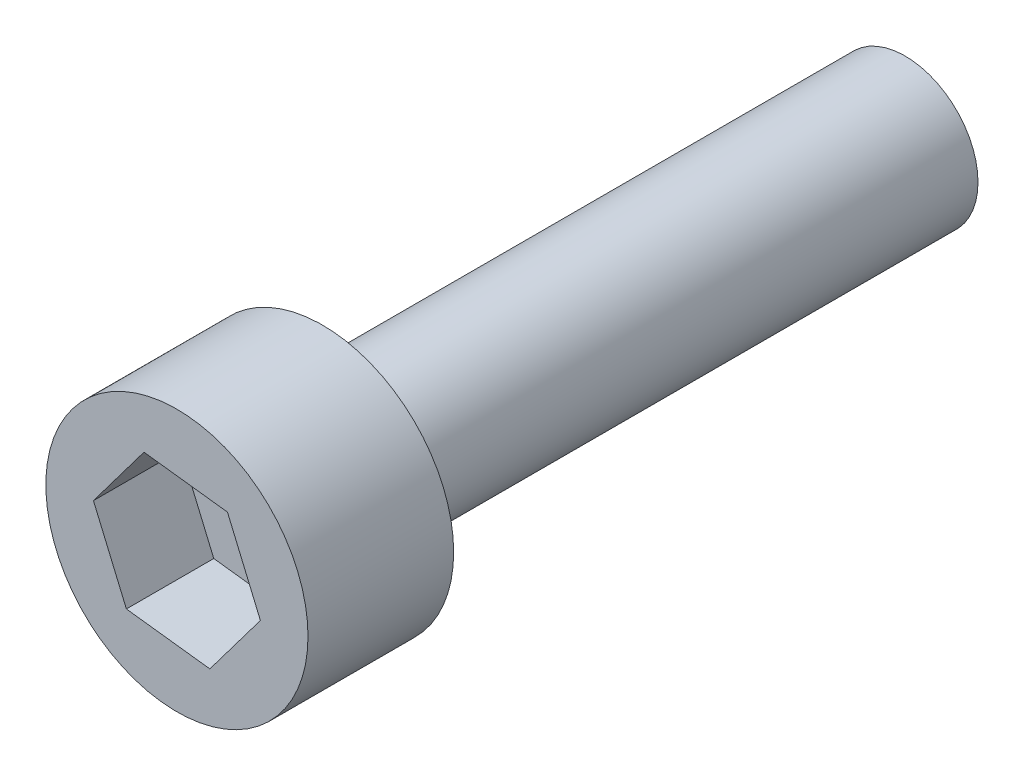
from build123d import *

# Parameters (mm, degrees)
ESQUISSE1_R             = 1.25
BOSS_EXTRU_1_DEPTH      = 10
ESQUISSE2_R             = 2.25
BOSS_EXTRU_2_DEPTH      = 2.5
ENL_V_MAT_EXTRU_1_DEPTH = 1.5


with BuildPart() as part:
    # Esquisse1 → Boss.-Extru.1 (new body)
    with BuildSketch(Plane.XY):
        Circle(ESQUISSE1_R)
    extrude(amount=BOSS_EXTRU_1_DEPTH)

    # Esquisse2 → Boss.-Extru.2 (add)
    with BuildSketch(Plane.XY.offset(10)):
        Circle(ESQUISSE2_R)
    extrude(amount=BOSS_EXTRU_2_DEPTH)

    # Esquisse3 → Enlèv. mat.-Extru.1 (cut)
    with BuildSketch(Plane.XY.offset(12.5)):
        Polygon((1.432795199, -0.174445549), (0.867471877, 1.153614266), (-0.565323322, 1.328059816), (-1.432795199, 0.174445549), (-0.867471877, -1.153614266), (0.565323322, -1.328059816), align=None)
    extrude(amount=-ENL_V_MAT_EXTRU_1_DEPTH, mode=Mode.SUBTRACT)


solid = part.part
